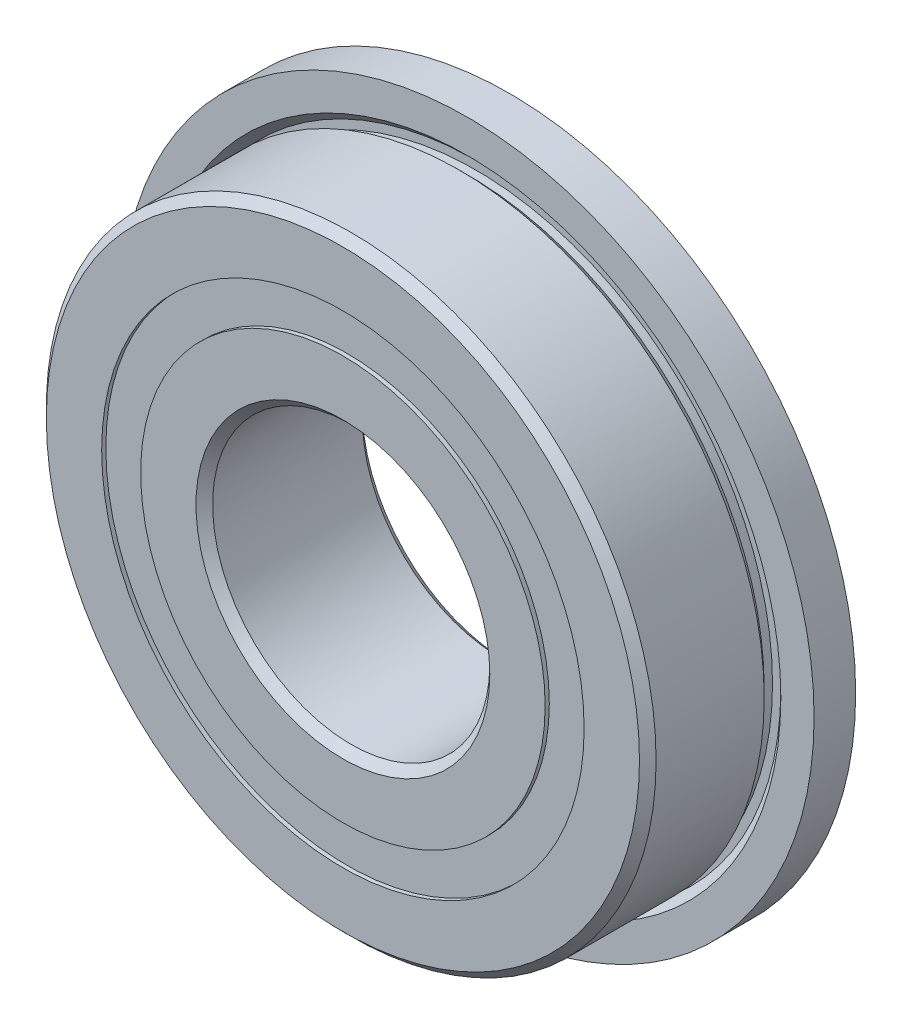
from build123d import *

# Parameters (mm, degrees)
SKETCH6_W         = 0.234432234
SKETCH6_H         = 0.703296704
CIRPATTERN1_COUNT = 10
SKETCH5_W         = 1.342550488
SKETCH5_H         = 1.406593406


with BuildPart() as part:
    # Sketch7 → Revolve7 (revolve)
    with BuildSketch(Plane(origin=(0, 0, 0), x_dir=(0, 0, -1), z_dir=(1, 0, 0))):
        with BuildLine():
            Line((3, 12.5), (1.5, 12.5))
            Line((1.5, 12.5), (1.5, 11.3))
            Line((1.5, 11.3), (1.8, 11))
            Line((1.8, 11), (1.8, 10.7))
            Line((1.8, 10.7), (1.5, 10.7))
            Line((1.5, 10.7), (1.2, 11))
            Line((1.2, 11), (-2.7, 11))
            Line((-2.7, 11), (-3, 10.7))
            Line((-3, 10.7), (-3, 8.703296703))
            Line((-3, 8.703296703), (-1.333333333, 8.703296703))
            ThreePointArc((-1.333333333, 8.703296703), (0, 9.507449512), (1.333333333, 8.703296703))
            Line((1.333333333, 8.703296703), (3, 8.703296703))
            Line((3, 8.703296703), (3, 10.7))
            Line((3, 10.7), (3, 12.5))
        make_face()
    revolve(axis=Axis((0, 0, 3), (0, 0, -1)))


with BuildPart() as body_2:
    # Sketch3 → Revolve3 (revolve)
    with BuildSketch(Plane(origin=(0, 0, 0), x_dir=(0, 0, -1), z_dir=(1, 0, 0))):
        with BuildLine():
            Line((-3, 7.296703297), (-1.333333333, 7.296703297))
            ThreePointArc((-1.333333333, 7.296703297), (0, 6.492550488), (1.333333333, 7.296703297))
            Line((1.333333333, 7.296703297), (3, 7.296703297))
            Line((3, 7.296703297), (3, 5.3))
            Line((3, 5.3), (2.7, 5))
            Line((2.7, 5), (-2.7, 5))
            Line((-2.7, 5), (-3, 5.3))
            Line((-3, 5.3), (-3, 7.296703297))
        make_face()
    revolve(axis=Axis((0, 0, 3), (0, 0, -1)))


with BuildPart() as body_3:
    # Sketch6 → Revolve6 (revolve)
    with BuildSketch(Plane(origin=(0, 0, 0), x_dir=(0, 0, -1), z_dir=(1, 0, 0))):
        with Locations((0, 8)):
            Rectangle(SKETCH6_W, SKETCH6_H)
    revolve(axis=Axis((0, 0, 3), (0, 0, -1)))


with BuildPart() as body_4:
    # Sketch4 → Revolve4 (revolve)
    with BuildSketch(Plane(origin=(0, 0, 0), x_dir=(0, 0, -1), z_dir=(1, 0, 0))):
        with BuildLine():
            Line((-1.507449512, 8), (1.507449512, 8))
            ThreePointArc((1.507449512, 8), (0, 9.507449512), (-1.507449512, 8))
        make_face()
    revolve(axis=Axis((0, 8, 1.507449512), (0, 0, -1)))


with BuildPart() as cirpattern1_1:
    # CirPattern1: pattern copy
    add(body_4.part.rotate(Axis((0, 0, -3), (0, 0, 1)), 1 * 360 / CIRPATTERN1_COUNT))


with BuildPart() as cirpattern1_2:
    # CirPattern1: pattern copy
    add(body_4.part.rotate(Axis((0, 0, -3), (0, 0, 1)), 2 * 360 / CIRPATTERN1_COUNT))


with BuildPart() as cirpattern1_3:
    # CirPattern1: pattern copy
    add(body_4.part.rotate(Axis((0, 0, -3), (0, 0, 1)), 3 * 360 / CIRPATTERN1_COUNT))


with BuildPart() as cirpattern1_4:
    # CirPattern1: pattern copy
    add(body_4.part.rotate(Axis((0, 0, -3), (0, 0, 1)), 4 * 360 / CIRPATTERN1_COUNT))


with BuildPart() as cirpattern1_5:
    # CirPattern1: pattern copy
    add(body_4.part.rotate(Axis((0, 0, -3), (0, 0, 1)), 5 * 360 / CIRPATTERN1_COUNT))


with BuildPart() as cirpattern1_6:
    # CirPattern1: pattern copy
    add(body_4.part.rotate(Axis((0, 0, -3), (0, 0, 1)), 6 * 360 / CIRPATTERN1_COUNT))


with BuildPart() as cirpattern1_7:
    # CirPattern1: pattern copy
    add(body_4.part.rotate(Axis((0, 0, -3), (0, 0, 1)), 7 * 360 / CIRPATTERN1_COUNT))


with BuildPart() as cirpattern1_8:
    # CirPattern1: pattern copy
    add(body_4.part.rotate(Axis((0, 0, -3), (0, 0, 1)), 8 * 360 / CIRPATTERN1_COUNT))


with BuildPart() as cirpattern1_9:
    # CirPattern1: pattern copy
    add(body_4.part.rotate(Axis((0, 0, -3), (0, 0, 1)), 9 * 360 / CIRPATTERN1_COUNT))


with BuildPart() as body_14:
    # Sketch5 → Revolve5 (revolve)
    with BuildSketch(Plane(origin=(0, 0, 0), x_dir=(0, 0, -1), z_dir=(1, 0, 0))):
        with Locations((-2.178724756, 8)):
            Rectangle(SKETCH5_W, SKETCH5_H)
        with Locations((2.178724756, 8)):
            Rectangle(SKETCH5_W, SKETCH5_H)
    revolve(axis=Axis((0, 0, 3), (0, 0, -1)))


solid = Compound([part.part, body_2.part, body_3.part, body_4.part, cirpattern1_1.part, cirpattern1_2.part, cirpattern1_3.part, cirpattern1_4.part, cirpattern1_5.part, cirpattern1_6.part, cirpattern1_7.part, cirpattern1_8.part, cirpattern1_9.part, body_14.part])
